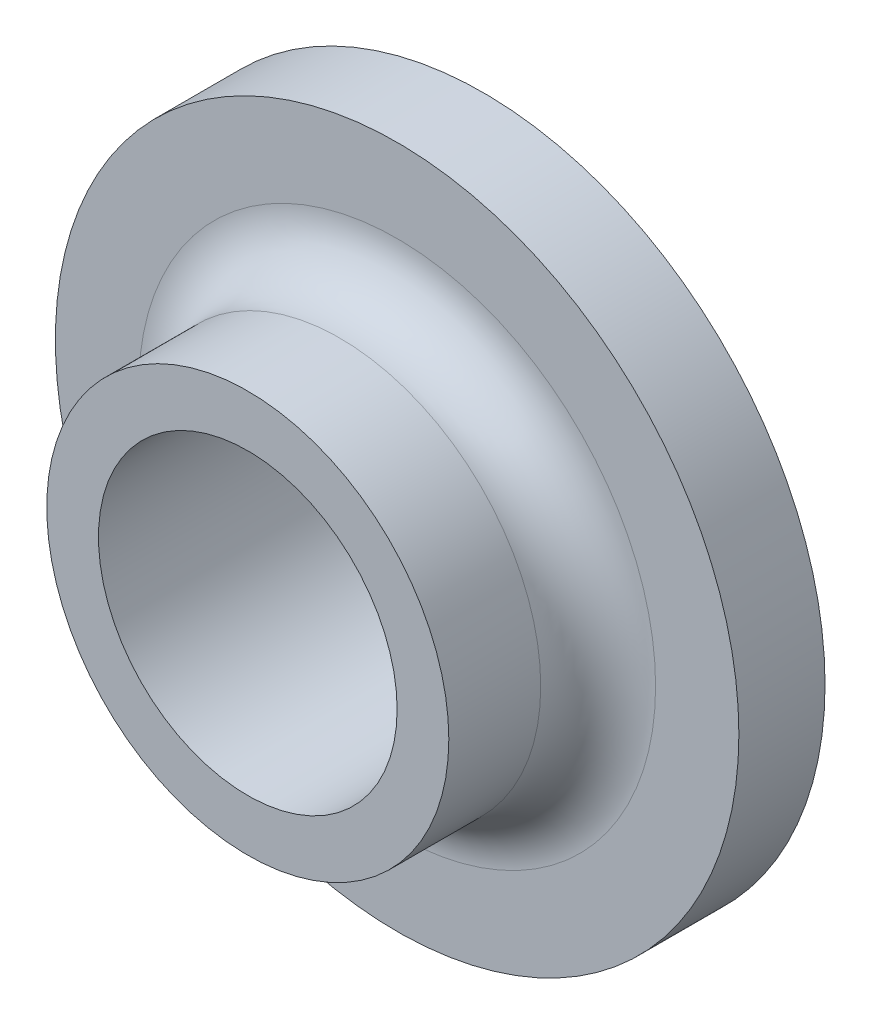
from build123d import *

# Parameters (mm, degrees)
SKETCH_1_R          = 5.95
SKETCH_1_R_2        = 3.5
EXTRUDE_1_DEPTH     = 1.5
SKETCH_1_2_R        = 3.5
EXTRUDE_2_DEPTH     = 4.1
SKETCH_2_R          = 2.6
CUT_EXTRUDE_1_DEPTH = 10.360288457
FILLET_1_R          = 1


with BuildPart() as part:
    # 草图1 → 凸台-拉伸1 (new body)
    with BuildSketch(Plane.XY):
        Circle(SKETCH_1_R)
        Circle(SKETCH_1_R_2, mode=Mode.SUBTRACT)
    extrude(amount=EXTRUDE_1_DEPTH)

    # 草图1<2> → 凸台-拉伸2 (add)
    with BuildSketch(Plane.XY):
        Circle(SKETCH_1_2_R)
    extrude(amount=EXTRUDE_2_DEPTH)

    # 草图2 → 切除-拉伸1 (cut, through all)
    with BuildSketch(Plane.XY):
        Circle(SKETCH_2_R)
    extrude(amount=CUT_EXTRUDE_1_DEPTH, mode=Mode.SUBTRACT)

    # 圆角1
    fillet_1_edges = [part.edges().sort_by_distance(p)[0] for p in [
        (-3.5, 0, 1.5),
    ]]
    fillet(fillet_1_edges, radius=FILLET_1_R)


solid = part.part
